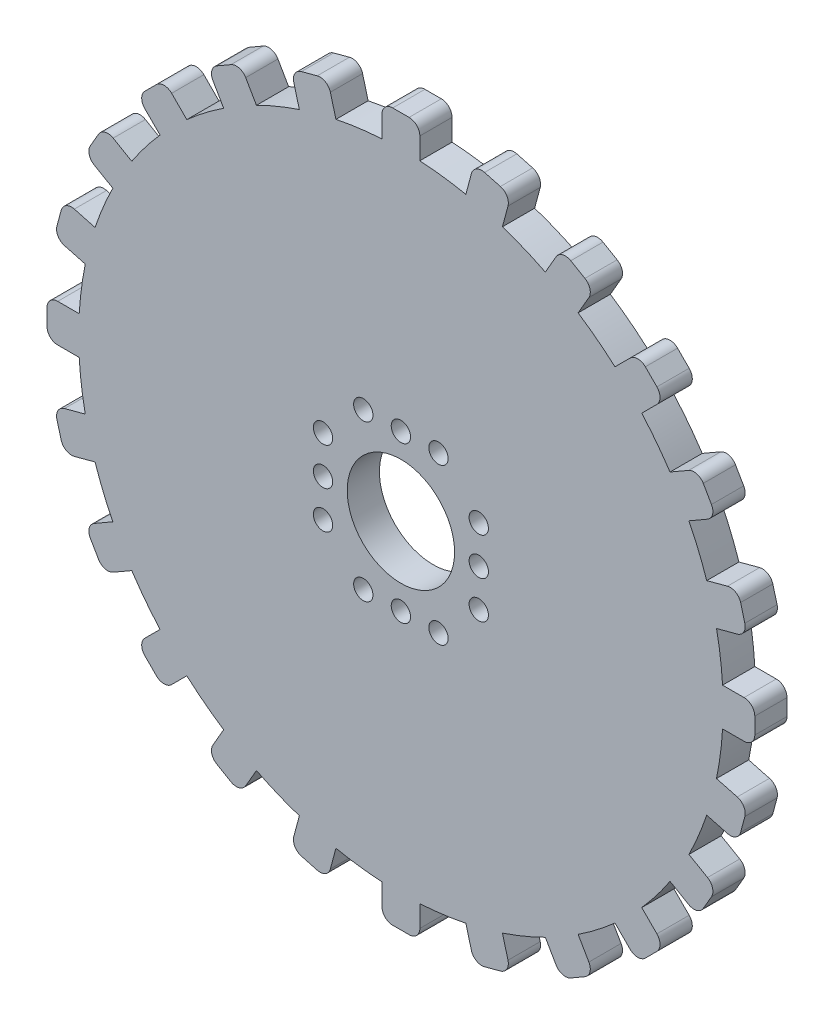
from build123d import *

# Parameters (mm, degrees)
SKETCH1_R                      = 30
SKETCH1_R_2                    = 5
SKETCH1_R_3                    = 0.7
BOSS_EXTRUDE1_DEPTH            = 3
BOSS_EXTRUDE2_DEPTH            = 3
CIRPATTERN2_COUNT              = 24
F_1_8_1_8_DIAMETER_HOLE1_D     = 1.8
F_1_8_1_8_DIAMETER_HOLE1_DEPTH = 10
F_1_8_1_8_DIAMETER_HOLE1_TIP   = 0.540774557


with BuildPart() as part:
    # Sketch1 → Boss-Extrude1 (new body)
    with BuildSketch(Plane.XY):
        Circle(SKETCH1_R)
        Circle(SKETCH1_R_2, mode=Mode.SUBTRACT)
        with Locations((-3.5, 7.25)):
            Circle(SKETCH1_R_3, mode=Mode.SUBTRACT)
        with Locations((0, 7.25)):
            Circle(SKETCH1_R_3, mode=Mode.SUBTRACT)
        with Locations((3.5, 7.25)):
            Circle(SKETCH1_R_3, mode=Mode.SUBTRACT)
        with Locations((7.25, 3.5)):
            Circle(SKETCH1_R_3, mode=Mode.SUBTRACT)
        with Locations((7.25, 0)):
            Circle(SKETCH1_R_3, mode=Mode.SUBTRACT)
        with Locations((7.25, -3.5)):
            Circle(SKETCH1_R_3, mode=Mode.SUBTRACT)
        with Locations((3.5, -7.25)):
            Circle(SKETCH1_R_3, mode=Mode.SUBTRACT)
        with Locations((0, -7.25)):
            Circle(SKETCH1_R_3, mode=Mode.SUBTRACT)
        with Locations((-3.5, -7.25)):
            Circle(SKETCH1_R_3, mode=Mode.SUBTRACT)
        with Locations((-7.25, -3.5)):
            Circle(SKETCH1_R_3, mode=Mode.SUBTRACT)
        with Locations((-7.25, 0)):
            Circle(SKETCH1_R_3, mode=Mode.SUBTRACT)
        with Locations((-7.25, 3.5)):
            Circle(SKETCH1_R_3, mode=Mode.SUBTRACT)
    extrude(amount=BOSS_EXTRUDE1_DEPTH)

    # Sketch2 → Boss-Extrude2 (add)
    with BuildSketch(Plane.XY.offset(3)):
        with BuildLine():
            Line((29.948176492, 1.762590363), (31.948176492, 1.762590363))
            ThreePointArc((31.948176492, 1.762590363), (32.655283273, 1.469697144), (32.948176492, 0.762590363))
            Line((32.948176492, 0.762590363), (32.948176492, -0.762590363))
            ThreePointArc((32.948176492, -0.762590363), (32.655283273, -1.469697144), (31.948176492, -1.762590363))
            Line((31.948176492, -1.762590363), (29.948176492, -1.762590363))
            Line((29.948176492, -1.762590363), (29.948176492, 1.762590363))
        make_face()
    boss_extrude2 = extrude(amount=-BOSS_EXTRUDE2_DEPTH)

    # CirPattern2: Boss-Extrude2 ×24 about axis
    cirpattern2_axis = Axis((0, 0, -0.15), (0, 0, 1))
    for i in range(1, CIRPATTERN2_COUNT):
        add(boss_extrude2.rotate(cirpattern2_axis, i * 360 / CIRPATTERN2_COUNT))

    # Ø1.8 (1.8) Diameter Hole1
    with Locations(Plane.XY.offset(3)):
        with Locations((-7.25, 0), (7.25, 0), (0, -7.25), (0, 7.25), (-3.5, 7.25), (3.5, 7.25), (7.25, 3.5), (7.25, -3.5), (-3.5, -7.25), (3.5, -7.25), (-7.25, -3.5), (-7.25, 3.5)):
            Hole(F_1_8_1_8_DIAMETER_HOLE1_D / 2, depth=F_1_8_1_8_DIAMETER_HOLE1_DEPTH)
            with Locations((0, 0, -(F_1_8_1_8_DIAMETER_HOLE1_DEPTH + F_1_8_1_8_DIAMETER_HOLE1_TIP / 2))):  # 118° drill point
                Cone(0, F_1_8_1_8_DIAMETER_HOLE1_D / 2, F_1_8_1_8_DIAMETER_HOLE1_TIP, mode=Mode.SUBTRACT)


solid = part.part
